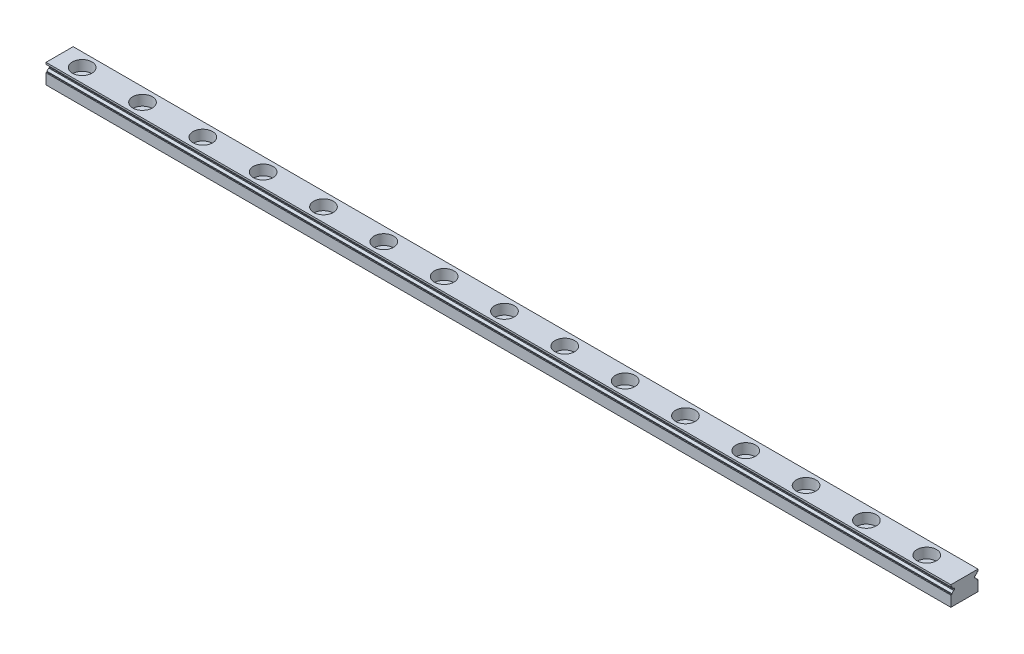
from build123d import *

# Parameters (mm, degrees)
BOSS_EXTRU_1_DEPTH                                 = 300
ESQUISSE2_W                                        = 0.3
ESQUISSE2_H                                        = 2.4
ENL_V_MAT_EXTRU_1_DEPTH                            = 301.104148588
CHAMBRAGE_POUR_VIS_T_TE_HEXAGONALE_M31_D           = 2.45875
CHAMBRAGE_POUR_VIS_T_TE_HEXAGONALE_M31_CBORE_D     = 6.5
CHAMBRAGE_POUR_VIS_T_TE_HEXAGONALE_M31_CBORE_DEPTH = 3.4
R_P_TITION_LIN_AIRE1_COUNT                         = 15
R_P_TITION_LIN_AIRE1_PITCH                         = 20


with BuildPart() as part:
    # Esquisse1 → Boss.-Extru.1 (new body)
    with BuildSketch(Plane(origin=(0, 0, 0), x_dir=(0, 0, -1), z_dir=(1, 0, 0))):
        Polygon((-4.5, 0), (4.5, 0), (4.5, 3.5), (3.6, 4.4), (3.3, 4.4), (3.3, 5), (3.6, 5), (4.5, 5.9), (4.5, 6.5), (-4.5, 6.5), (-4.5, 5.9), (-3.6, 5), (-3.3, 5), (-3.3, 4.4), (-3.6, 4.4), (-4.5, 3.5), align=None)
    extrude(amount=BOSS_EXTRU_1_DEPTH)

    # Esquisse2 → Enlèv. mat.-Extru.1 (cut, through all)
    with BuildSketch(Plane(origin=(0, 0, 0), x_dir=(0, 0, -1), z_dir=(1, 0, 0))):
        with Locations((4.35, 4.7)):
            Rectangle(ESQUISSE2_W, ESQUISSE2_H)
        with Locations((-4.35, 4.7)):
            Rectangle(ESQUISSE2_W, ESQUISSE2_H)
    extrude(amount=ENL_V_MAT_EXTRU_1_DEPTH, mode=Mode.SUBTRACT)

    # Chambrage pour vis à tête hexagonale M31 (through all)
    with Locations(Plane(origin=(0, 6.5, 0), x_dir=(1, 0, 0), z_dir=(0, 1, 0))):
        with Locations((7.5, 0)):
            chambrage_pour_vis_t_te_hexagonale_m31 = CounterBoreHole(CHAMBRAGE_POUR_VIS_T_TE_HEXAGONALE_M31_D / 2, CHAMBRAGE_POUR_VIS_T_TE_HEXAGONALE_M31_CBORE_D / 2, CHAMBRAGE_POUR_VIS_T_TE_HEXAGONALE_M31_CBORE_DEPTH)

    # Répétition linéaire1: Chambrage pour vis à tête hexagonale M31 ×15
    with Locations(*[(i * R_P_TITION_LIN_AIRE1_PITCH, 0, 0) for i in range(1, R_P_TITION_LIN_AIRE1_COUNT)]):
        add(chambrage_pour_vis_t_te_hexagonale_m31, mode=Mode.SUBTRACT)


solid = part.part
